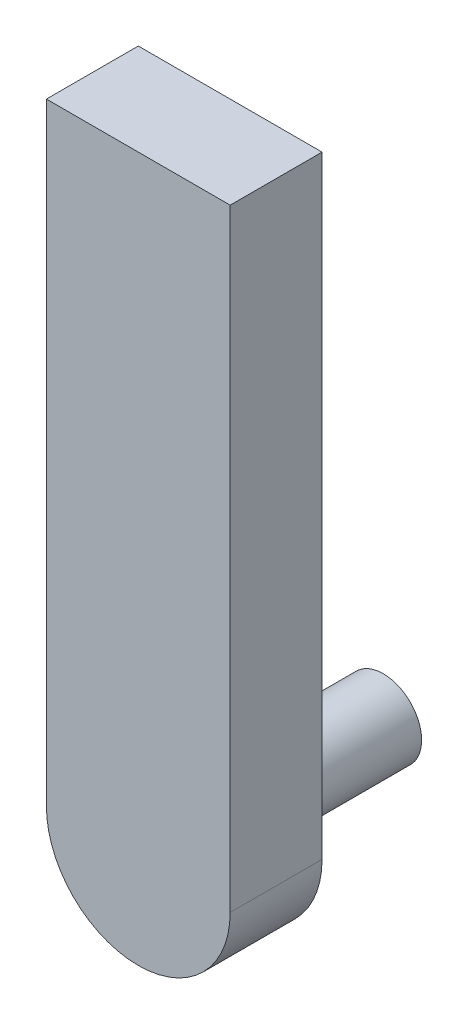
from build123d import *

# Parameters (mm, degrees)
EXTRUDE_1_DEPTH = 6
SKETCH_2_R      = 2.5
EXTRUDE_2_DEPTH = 10


with BuildPart() as part:
    # 草圖1 → 伸長1 (new body)
    with BuildSketch(Plane.XY):
        with BuildLine():
            Line((-6, 40), (-6, 0))
            ThreePointArc((-6, 0), (0, -6), (6, 0))
            Line((6, 0), (6, 40))
            Line((6, 40), (-6, 40))
        make_face()
    extrude(amount=EXTRUDE_1_DEPTH)

    # 草圖2 → 伸長2 (add)
    with BuildSketch(Plane(origin=(0, 0, 0), x_dir=(-1, 0, 0), z_dir=(0, 0, -1))):
        with Locations(Location((0, 0, 0), (0, 0, 180))):
            Circle(SKETCH_2_R)
    extrude(amount=EXTRUDE_2_DEPTH)


solid = part.part
